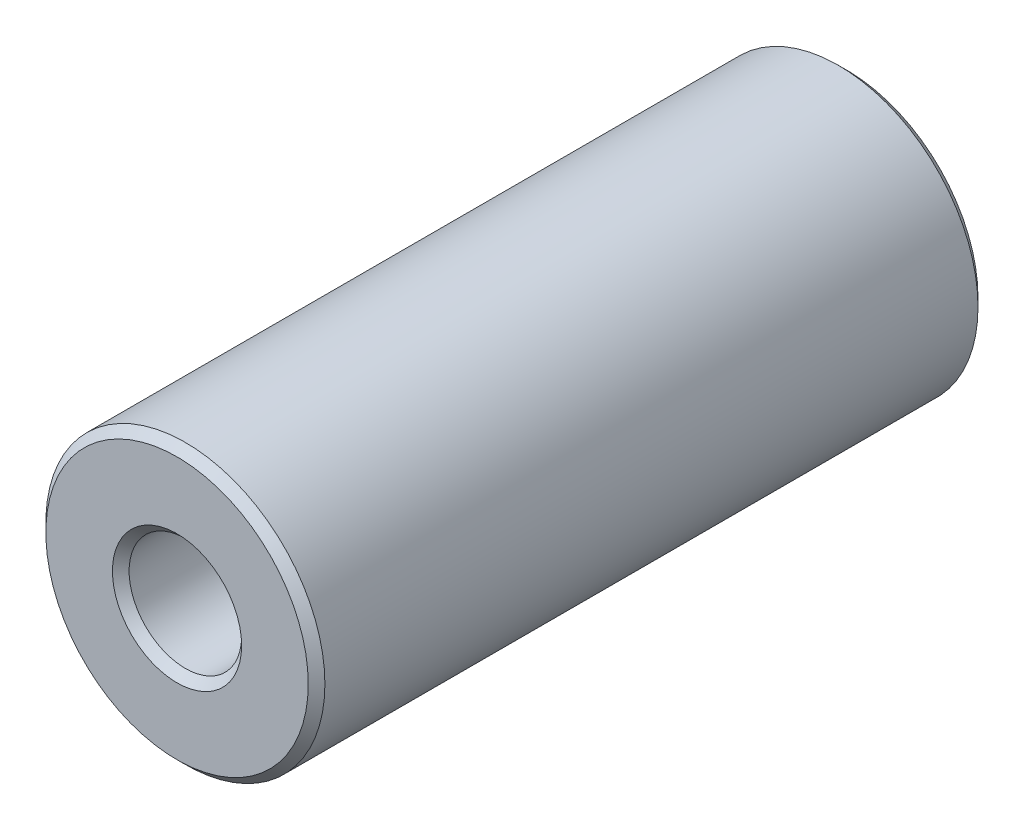
from build123d import *

# Parameters (mm, degrees)
BOSS_EXTRUDE1_DEPTH      = 19.05
BOSS_EXTRUDE1_DEPTH_BACK = 19.05
SKETCH3_R                = 7.9375
SKETCH3_R_2              = 3.2004
CHAMFER1_SIZE            = 0.47371


with BuildPart() as part:
    # Sketch3 → Boss-Extrude1 (new, two sides: drawn at the far end of the back side and taken through both)
    with BuildSketch(Plane.XY.offset(-BOSS_EXTRUDE1_DEPTH_BACK)):
        Circle(SKETCH3_R)
        Circle(SKETCH3_R_2, mode=Mode.SUBTRACT)
    extrude(amount=BOSS_EXTRUDE1_DEPTH + BOSS_EXTRUDE1_DEPTH_BACK)

    # Chamfer1
    chamfer1_edges = [part.edges().sort_by_distance(p)[0] for p in [
        (-7.9375, 0, -19.05),
        (-3.2004, 0, -19.05),
        (-7.9375, 0, 19.05),
        (-3.2004, 0, 19.05),
    ]]
    chamfer(chamfer1_edges, length=CHAMFER1_SIZE)


solid = part.part
